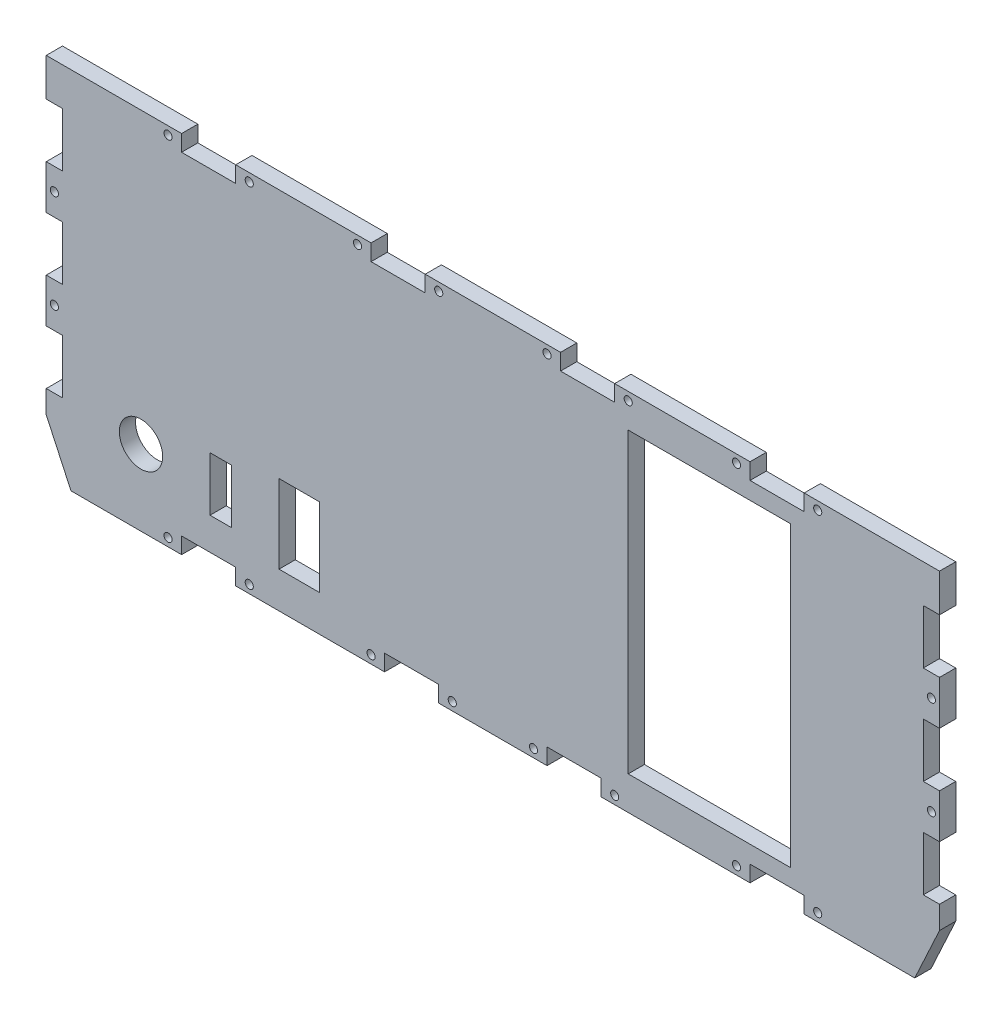
from build123d import *

# Parameters (mm, degrees)
BOSS_EXTRU_1_DEPTH      = 6
ESQUISSE3_R             = 8
ESQUISSE3_W             = 6
ESQUISSE3_H             = 20
ESQUISSE3_W_2           = 20
ESQUISSE3_H_2           = 6
ESQUISSE3_W_3           = 60
ESQUISSE3_H_3           = 110
ESQUISSE3_W_4           = 8
ESQUISSE3_W_5           = 15
ESQUISSE3_H_4           = 29
ENL_V_MAT_EXTRU_2_DEPTH = 6
ESQUISSE4_R             = 1.5
ENL_V_MAT_EXTRU_3_DEPTH = 6
ESQUISSE5_W             = 456.045253014
ESQUISSE5_H             = 136.228984631
ENL_V_MAT_EXTRU_4_DEPTH = 6


with BuildPart() as part:
    # Esquisse1 → Boss.-Extru.1 (new body)
    with BuildSketch(Plane.XY):
        Polygon((-165, 96.73), (165, 96.73), (165, -18.27), (123, -109.022410436), (-123, -109.022410436), (-165, -18.27), align=None)
    extrude(amount=BOSS_EXTRU_1_DEPTH)

    # Esquisse3 → Enlèv. mat.-Extru.2 (cut)
    with BuildSketch(Plane(origin=(0, 0, 0), x_dir=(-1, 0, 0), z_dir=(0, 0, -1))):
        with Locations((130, -10.145)):
            Circle(ESQUISSE3_R)
        with Locations((162, 36.44)):
            Rectangle(ESQUISSE3_W, ESQUISSE3_H)
        with Locations((162, 72.73)):
            Rectangle(ESQUISSE3_W, ESQUISSE3_H)
        with Locations((162, 0.15)):
            Rectangle(ESQUISSE3_W, ESQUISSE3_H)
        with Locations((-30, -35.02)):
            Rectangle(ESQUISSE3_W_2, ESQUISSE3_H_2)
        with Locations((105, -35.02)):
            Rectangle(ESQUISSE3_W_2, ESQUISSE3_H_2)
        with Locations((-80, 29.355)):
            Rectangle(ESQUISSE3_W_3, ESQUISSE3_H_3)
        with Locations((-162, 72.73)):
            Rectangle(ESQUISSE3_W, ESQUISSE3_H)
        with Locations((30, -35.02)):
            Rectangle(ESQUISSE3_W_2, ESQUISSE3_H_2)
        with Locations((-162, 36.44)):
            Rectangle(ESQUISSE3_W, ESQUISSE3_H)
        with Locations((-162, 0.15)):
            Rectangle(ESQUISSE3_W, ESQUISSE3_H)
        with Locations((105, 93.73)):
            Rectangle(ESQUISSE3_W_2, ESQUISSE3_H_2)
        with Locations((-35, 93.73)):
            Rectangle(ESQUISSE3_W_2, ESQUISSE3_H_2)
        with Locations((35, 93.73)):
            Rectangle(ESQUISSE3_W_2, ESQUISSE3_H_2)
        with Locations((-105, 93.73)):
            Rectangle(ESQUISSE3_W_2, ESQUISSE3_H_2)
        with Locations((100.5, -10.145)):
            Rectangle(ESQUISSE3_W_4, ESQUISSE3_H)
        with Locations((-105, -35.02)):
            Rectangle(ESQUISSE3_W_2, ESQUISSE3_H_2)
        with Locations((71.5, -10.145)):
            Rectangle(ESQUISSE3_W_5, ESQUISSE3_H_4)
    extrude(amount=-ENL_V_MAT_EXTRU_2_DEPTH, mode=Mode.SUBTRACT)

    # Esquisse4 → Enlèv. mat.-Extru.3 (cut)
    with BuildSketch(Plane(origin=(0, 0, 0), x_dir=(-1, 0, 0), z_dir=(0, 0, -1))):
        with Locations(Location((162, 18.29, 0), (0, 0, 180))):
            Circle(ESQUISSE4_R)
        with Locations((120, -35.02)):
            Circle(ESQUISSE4_R)
        with Locations(Location((162, 54.585, 0), (0, 0, 180))):
            Circle(ESQUISSE4_R)
        with Locations((90, -35.02)):
            Circle(ESQUISSE4_R)
        with Locations((45, -35.02)):
            Circle(ESQUISSE4_R)
        with Locations((15, -35.02)):
            Circle(ESQUISSE4_R)
        with Locations(Location((-15, -35.02, 0), (0, 0, 180))):
            Circle(ESQUISSE4_R)
        with Locations(Location((-45, -35.02, 0), (0, 0, 180))):
            Circle(ESQUISSE4_R)
        with Locations(Location((-90, -35.02, 0), (0, 0, 180))):
            Circle(ESQUISSE4_R)
        with Locations((120, 93.73)):
            Circle(ESQUISSE4_R)
        with Locations(Location((-120, -35.02, 0), (0, 0, 180))):
            Circle(ESQUISSE4_R)
        with Locations((90, 93.73)):
            Circle(ESQUISSE4_R)
        with Locations((50, 93.73)):
            Circle(ESQUISSE4_R)
        with Locations((20, 93.73)):
            Circle(ESQUISSE4_R)
        with Locations((-162, 18.29)):
            Circle(ESQUISSE4_R)
        with Locations((-162, 54.585)):
            Circle(ESQUISSE4_R)
        with Locations(Location((-20, 93.73, 0), (0, 0, 180))):
            Circle(ESQUISSE4_R)
        with Locations(Location((-50, 93.73, 0), (0, 0, 180))):
            Circle(ESQUISSE4_R)
        with Locations(Location((-90, 93.73, 0), (0, 0, 180))):
            Circle(ESQUISSE4_R)
        with Locations(Location((-120, 93.73, 0), (0, 0, 180))):
            Circle(ESQUISSE4_R)
    extrude(amount=-ENL_V_MAT_EXTRU_3_DEPTH, mode=Mode.SUBTRACT)

    # Esquisse5 → Enlèv. mat.-Extru.4 (cut)
    with BuildSketch(Plane(origin=(0, 0, 0), x_dir=(-1, 0, 0), z_dir=(0, 0, -1))):
        with Locations((-18.307092018, -106.134492316)):
            Rectangle(ESQUISSE5_W, ESQUISSE5_H)
    extrude(amount=-ENL_V_MAT_EXTRU_4_DEPTH, mode=Mode.SUBTRACT)


solid = part.part
